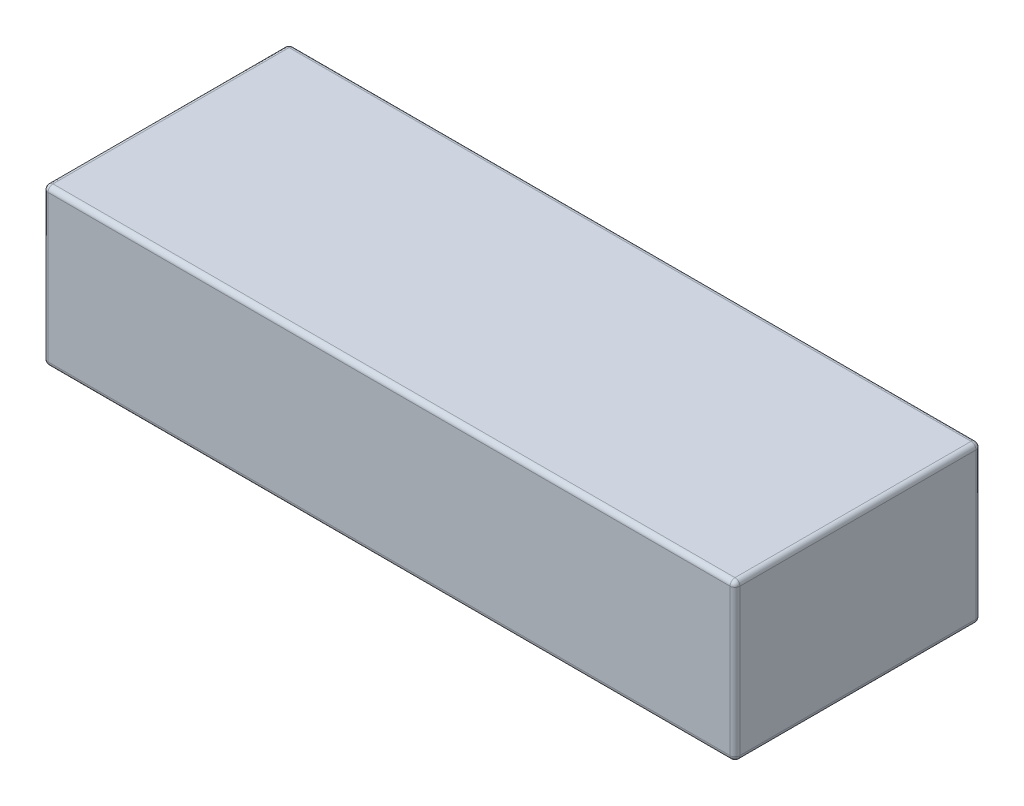
from build123d import *

# Parameters (mm, degrees)
SKETCH1_W           = 140.1
SKETCH1_H           = 49.8
BOSS_EXTRUDE1_DEPTH = 15.85
FILLET1_R           = 1
FILLET2_R           = 1


with BuildPart() as part:
    # Sketch1 → Boss-Extrude1 (new, symmetric)
    with BuildSketch(Plane(origin=(0, 0, 0), x_dir=(1, 0, 0), z_dir=(0, 1, 0))):
        Rectangle(SKETCH1_W, SKETCH1_H)
    extrude(amount=BOSS_EXTRUDE1_DEPTH, both=True)

    # Fillet1
    fillet1_edges = [part.edges().sort_by_distance(p)[0] for p in [
        (0, 15.85, 24.9),
        (0, -15.85, 24.9),
        (0, -15.85, -24.9),
        (0, 15.85, -24.9),
    ]]
    fillet(fillet1_edges, radius=FILLET1_R)

    # Fillet2
    fillet2_edges = [part.edges().sort_by_distance(p)[0] for p in [
        (-70.05, 0, -24.9),
        (70.05, 0, -24.9),
        (-70.05, -15.85, 0),
        (-70.05, 0, 24.9),
        (-70.05, 15.85, 0),
        (-70.05, 15.557106781, 24.607106781),
        (-70.05, 15.557106781, -24.607106781),
        (-70.05, -15.557106781, 24.607106781),
        (-70.05, -15.557106781, -24.607106781),
        (70.05, -15.85, 0),
        (70.05, 15.85, 0),
        (70.05, 0, 24.9),
        (70.05, 15.557106781, 24.607106781),
        (70.05, 15.557106781, -24.607106781),
        (70.05, -15.557106781, 24.607106781),
        (70.05, -15.557106781, -24.607106781),
    ]]
    fillet(fillet2_edges, radius=FILLET2_R)


solid = part.part
